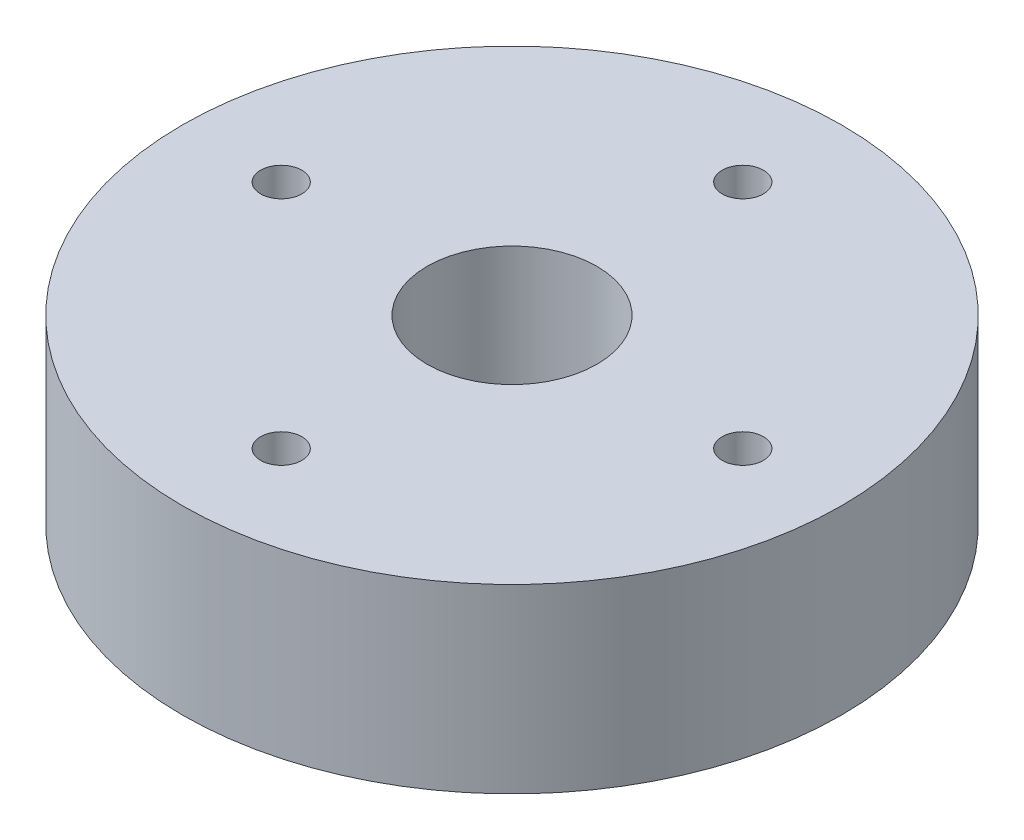
from build123d import *

# Parameters (mm, degrees)
SKETCH_1_R             = 20
SKETCH_1_R_2           = 5.15
EXTRUDE_1_DEPTH        = 6
EXTRUDE_START          = 5
SKETCH_2_R             = 20
SKETCH_2_R_2           = 19
SKETCH_2_R_3           = 6.5
SKETCH_2_R_4           = 5.15
EXTRUDE_2_DEPTH        = 5
EXTRUDE_START_2        = 7
SKETCH_3_R             = 6.5
SKETCH_3_R_2           = 5.15
EXTRUDE_3_DEPTH        = 7
HOLE_WIZARD_M3_1_D     = 2.5
HOLE_WIZARD_M3_1_DEPTH = 5
HOLE_WIZARD_M3_1_TIP   = 0.751075774


with BuildPart() as part:
    # 草图1 → 凸台-拉伸1 (new body)
    with BuildSketch(Plane(origin=(0, 0, 0), x_dir=(1, 0, 0), z_dir=(0, 1, 0))):
        with Locations(Location((0, 0, 0), (0, 0, 270))):
            Circle(SKETCH_1_R)
        with Locations(Location((0, 0, 0), (0, 0, 270))):
            Circle(SKETCH_1_R_2, mode=Mode.SUBTRACT)
    extrude(amount=EXTRUDE_1_DEPTH)

    # 草图2 → 凸台-拉伸2 (add)
    # profile 1 of 2: a face of its own
    with BuildSketch(Plane.XZ.offset(EXTRUDE_START)):
        with Locations(Location((0, 0, 0), (0, 0, 270))):
            Circle(SKETCH_2_R)
        with Locations(Location((0, 0, 0), (0, 0, 270))):
            Circle(SKETCH_2_R_2, mode=Mode.SUBTRACT)
    # profile 2 of 2: a face of its own
    with BuildSketch(Plane.XZ.offset(EXTRUDE_START)):
        with Locations(Location((0, 0, 0), (0, 0, 90))):
            Circle(SKETCH_2_R_3)
        with Locations(Location((0, 0, 0), (0, 0, 270))):
            Circle(SKETCH_2_R_4, mode=Mode.SUBTRACT)
    extrude(amount=-EXTRUDE_2_DEPTH)

    # 草图3 → 凸台-拉伸3 (add)
    with BuildSketch(Plane.XZ.offset(5).offset(EXTRUDE_START_2)):
        with Locations(Location((0, 0, 0), (0, 0, 90))):
            Circle(SKETCH_3_R)
        with Locations(Location((0, 0, 0), (0, 0, 270))):
            Circle(SKETCH_3_R_2, mode=Mode.SUBTRACT)
    extrude(amount=-EXTRUDE_3_DEPTH)

    # M3 螺纹孔1
    with Locations(Plane(origin=(0, 6, 0), x_dir=(1, 0, 0), z_dir=(0, 1, 0))):
        with Locations((0, 14), (0, -14), (14, 0), (-14, 0)):
            Hole(HOLE_WIZARD_M3_1_D / 2, depth=HOLE_WIZARD_M3_1_DEPTH)
            with Locations((0, 0, -(HOLE_WIZARD_M3_1_DEPTH + HOLE_WIZARD_M3_1_TIP / 2))):  # 118° drill point
                Cone(0, HOLE_WIZARD_M3_1_D / 2, HOLE_WIZARD_M3_1_TIP, mode=Mode.SUBTRACT)


solid = part.part
